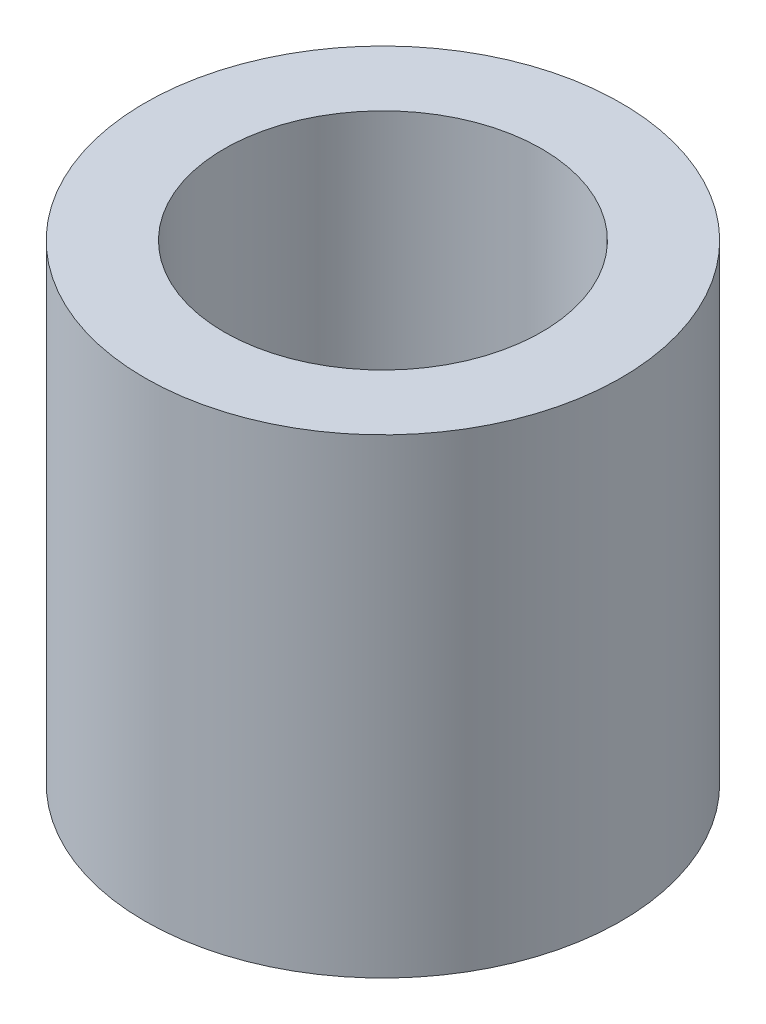
from build123d import *

# Parameters (mm, degrees)
SKETCH1_R           = 9
SKETCH1_R_2         = 6
BOSS_EXTRUDE1_DEPTH = 17.78


with BuildPart() as part:
    # Sketch1 → Boss-Extrude1 (new body)
    with BuildSketch(Plane(origin=(0, 0, 0), x_dir=(1, 0, 0), z_dir=(0, 1, 0))):
        with Locations(Location((0, 0, 0), (0, 0, 270))):
            Circle(SKETCH1_R)
        with Locations(Location((0, 0, 0), (0, 0, 270))):
            Circle(SKETCH1_R_2, mode=Mode.SUBTRACT)
    extrude(amount=BOSS_EXTRUDE1_DEPTH)


solid = part.part
